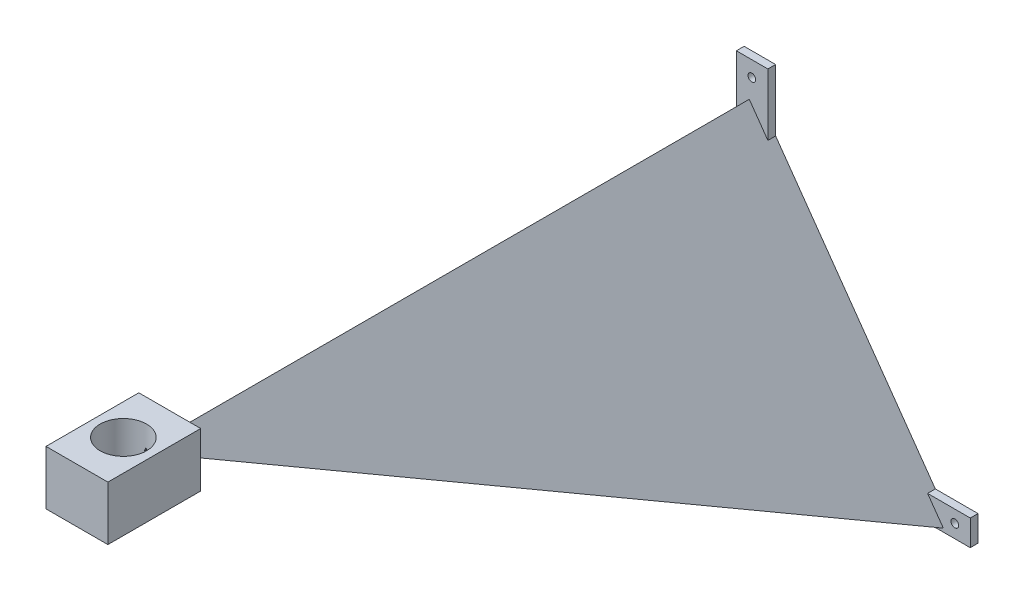
from build123d import *

# Parameters (mm, degrees)
ESBO_O11_W               = 40
ESBO_O11_H               = 35
CORTE_EXTRUS_O2_DEPTH    = 20
ESBO_O12_W               = 40
ESBO_O12_H               = 35
RESSALTO_EXTRUS_O2_DEPTH = 60
ESBO_O14_R               = 15
CORTE_EXTRUS_O3_DEPTH    = 30
ESBO_O16_W               = 51.962510692
ESBO_O16_H               = 33.256097344
CORTE_EXTRUS_O5_DEPTH    = 5
ESBO_O17_W               = 50
ESBO_O17_H               = 16.628048672
RESSALTO_EXTRUS_O3_DEPTH = 5
ESBO_O18_W               = 68.360533092
ESBO_O18_H               = 33.256097344
CORTE_EXTRUS_O7_DEPTH    = 5
ESBO_O19_W               = 50
ESBO_O19_H               = 16.628048672
RESSALTO_EXTRUS_O4_DEPTH = 5
ESBO_O20_W               = 24.072418746
ESBO_O20_H               = 34.036375749
CORTE_EXTRUS_O8_DEPTH    = 5
ESBO_O21_W               = 20.37066465
ESBO_O21_H               = 40
RESSALTO_EXTRUS_O5_DEPTH = 5
ESBO_O22_R               = 2.5
CORTE_EXTRUS_O9_DEPTH    = 10
ESBO_O23_R               = 2.5
CORTE_EXTRUS_O10_DEPTH   = 10


with BuildPart() as part:
    # Esboço2 → Loft1 section 0
    with BuildSketch(Plane.XY, mode=Mode.PRIVATE) as loft1_s0:
        with BuildLine():
            Line((-10.863095238, 0), (204.136904762, 0))
            Line((204.136904762, 0), (77.102021041, 179.616642653))
            Line((77.102021041, 179.616642653), (-10.863095238, 0))
        make_face()
    loft([loft1_s0.sketch, Vertex(77.102021041, 179.616642653, 400)])

    # Esboço11 → Corte-extrusão2 (cut)
    with BuildSketch(Plane(origin=(77.102021041, 179.616642653, 400), x_dir=(1, 0, 0), z_dir=(0, 0, 1))):
        Rectangle(ESBO_O11_W, ESBO_O11_H)
    extrude(amount=-CORTE_EXTRUS_O2_DEPTH, mode=Mode.SUBTRACT)

    # Esboço12 → Ressalto-extrusão2 (add)
    with BuildSketch(Plane.XY.offset(380)):
        with Locations((77.5, 175.5)):
            Rectangle(ESBO_O12_W, ESBO_O12_H)
    extrude(amount=RESSALTO_EXTRUS_O2_DEPTH)

    # Esboço14 → Corte-extrusão3 (cut)
    with BuildSketch(Plane(origin=(0, 193, 0), x_dir=(1, 0, 0), z_dir=(0, 1, 0))):
        with Locations((77.5, -410)):
            Circle(ESBO_O14_R)
    extrude(amount=-CORTE_EXTRUS_O3_DEPTH, mode=Mode.SUBTRACT)

    # Esboço16 → Corte-extrusão5 (cut)
    with BuildSketch(Plane(origin=(0, 0, 0), x_dir=(-1, 0, 0), z_dir=(0, 0, -1))):
        with Locations((10.863095238, 0)):
            Rectangle(ESBO_O16_W, ESBO_O16_H)
    extrude(amount=-CORTE_EXTRUS_O5_DEPTH, mode=Mode.SUBTRACT)

    # Esboço17 → Ressalto-extrusão3 (add)
    with BuildSketch(Plane(origin=(0, 0, 5), x_dir=(-1, 0, 0), z_dir=(0, 0, -1))):
        with Locations((9.881839892, 8.314024336)):
            Rectangle(ESBO_O17_W, ESBO_O17_H)
    extrude(amount=RESSALTO_EXTRUS_O3_DEPTH)

    # Esboço18 → Corte-extrusão7 (cut)
    with BuildSketch(Plane(origin=(0, 0, 0), x_dir=(-1, 0, 0), z_dir=(0, 0, -1))):
        with Locations((-204.136904762, 0)):
            Rectangle(ESBO_O18_W, ESBO_O18_H)
    extrude(amount=-CORTE_EXTRUS_O7_DEPTH, mode=Mode.SUBTRACT)

    # Esboço19 → Ressalto-extrusão4 (add)
    with BuildSketch(Plane(origin=(0, 0, 5), x_dir=(-1, 0, 0), z_dir=(0, 0, -1))):
        with Locations((-194.956638216, 8.314024336)):
            Rectangle(ESBO_O19_W, ESBO_O19_H)
    extrude(amount=RESSALTO_EXTRUS_O4_DEPTH)

    # Esboço20 → Corte-extrusão8 (cut)
    with BuildSketch(Plane(origin=(0, 0, 0), x_dir=(-1, 0, 0), z_dir=(0, 0, -1))):
        with Locations((-77.102021041, 179.616642654)):
            Rectangle(ESBO_O20_W, ESBO_O20_H)
    extrude(amount=-CORTE_EXTRUS_O8_DEPTH, mode=Mode.SUBTRACT)

    # Esboço21 → Ressalto-extrusão5 (add)
    with BuildSketch(Plane(origin=(0, 0, 5), x_dir=(-1, 0, 0), z_dir=(0, 0, -1))):
        with Locations((-78.952898089, 182.598454779)):
            Rectangle(ESBO_O21_W, ESBO_O21_H)
    extrude(amount=RESSALTO_EXTRUS_O5_DEPTH)

    # Esboço22 → Corte-extrusão9 (cut)
    with BuildSketch(Plane.XY.offset(5)):
        with Locations((209.956638216, 8.628048672)):
            Circle(ESBO_O22_R)
        with Locations((-24.881839892, 8.628048672)):
            Circle(ESBO_O22_R)
    extrude(amount=-CORTE_EXTRUS_O9_DEPTH, mode=Mode.SUBTRACT)

    # Esboço23 → Corte-extrusão10 (cut)
    with BuildSketch(Plane(origin=(0, 0, 0), x_dir=(-1, 0, 0), z_dir=(0, 0, -1))):
        with Locations((-78.767565764, 192.598454779)):
            Circle(ESBO_O23_R)
    extrude(amount=-CORTE_EXTRUS_O10_DEPTH, mode=Mode.SUBTRACT)

    # Esboço26 → Loft de corte2 section 0
    with BuildSketch(Plane(origin=(0, 0, 0), x_dir=(-1, 0, 0), z_dir=(0, 0, -1)), mode=Mode.PRIVATE) as loft_de_corte2_s0:
        with BuildLine():
            Line((-188.207571555, 2.5), (-3.793574091, 2.5))
            Line((-3.793574091, 2.5), (-0.470951602, 17.45900541))
            Line((-0.470951602, 17.45900541), (-69.973362487, 159.376508934))
            Line((-69.973362487, 159.376508934), (-88.373391622, 159.350353061))
            Line((-88.373391622, 159.350353061), (-189.84504863, 15.877963255))
            Line((-189.84504863, 15.877963255), (-188.207571555, 2.5))
        make_face()
    loft([loft_de_corte2_s0.sketch, Vertex(77.102021041, 179.616642653, 400)], mode=Mode.SUBTRACT)


solid = part.part
